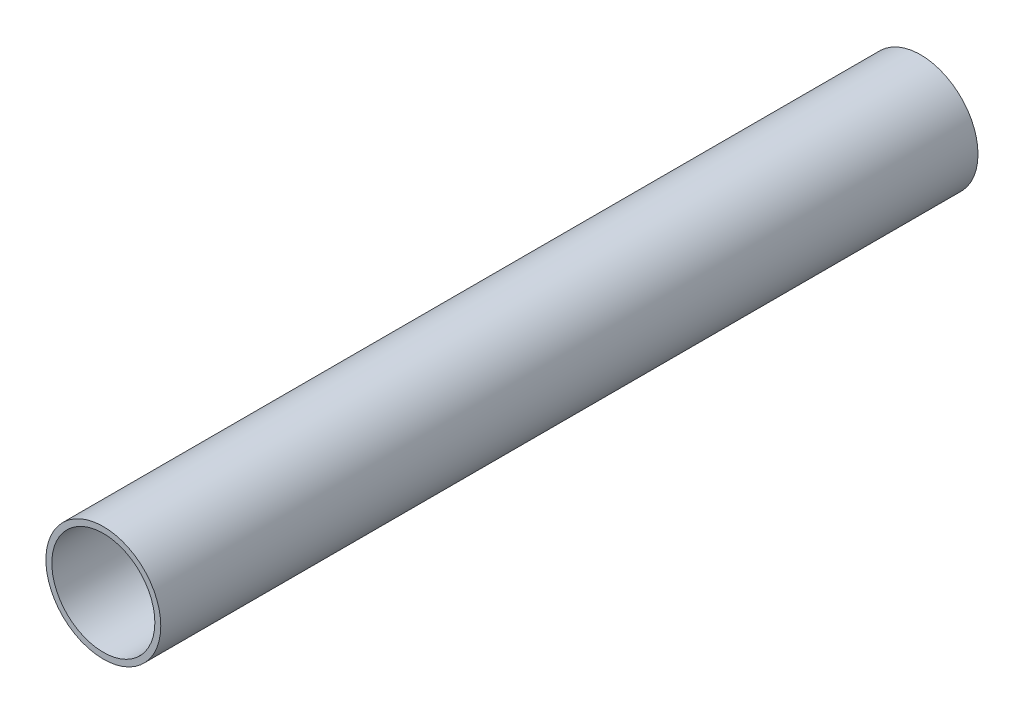
from build123d import *

# Parameters (mm, degrees)
SKETCH1_R           = 24.25
SKETCH1_R_2         = 21.75
BOSS_EXTRUDE1_DEPTH = 345


with BuildPart() as part:
    # Sketch1 → Boss-Extrude1 (new body)
    with BuildSketch(Plane.XY):
        Circle(SKETCH1_R)
        Circle(SKETCH1_R_2, mode=Mode.SUBTRACT)
    extrude(amount=-BOSS_EXTRUDE1_DEPTH)


solid = part.part
